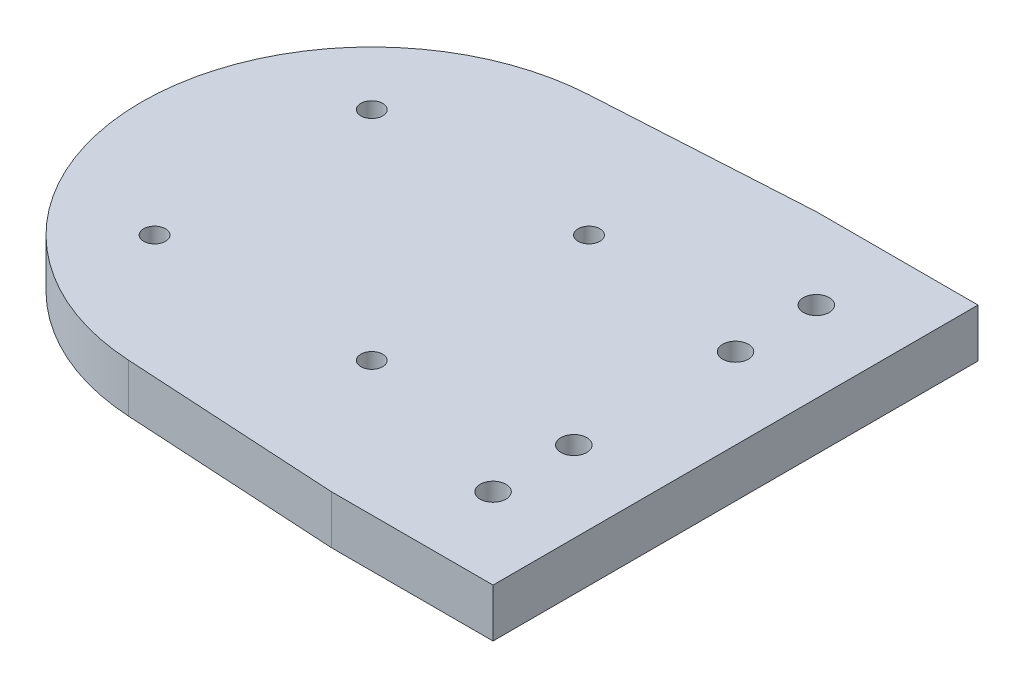
from build123d import *

# Parameters (mm, degrees)
EXTRUDE_1_DEPTH     = 6
SKETCH_2_R          = 1.35
CUT_EXTRUDE_1_DEPTH = 6
SKETCH_4_R          = 1.6
CUT_EXTRUDE_2_DEPTH = 6


with BuildPart() as part:
    # 草图1 → 凸台-拉伸1 (new body)
    with BuildSketch(Plane(origin=(0, 0, 0), x_dir=(1, 0, 0), z_dir=(0, 1, 0))):
        with BuildLine():
            Line((45, -30), (45, 30))
            Line((45, 30), (25, 30))
            Line((25, 30), (-1.65246447, 28.452053725))
            ThreePointArc((-1.65246447, 28.452053725), (-28.5, 0), (-1.65246447, -28.452053725))
            Line((-1.65246447, -28.452053725), (25, -30))
            Line((25, -30), (45, -30))
        make_face()
    extrude(amount=EXTRUDE_1_DEPTH)

    # 草图2 → 切除-拉伸1 (cut)
    with BuildSketch(Plane(origin=(0, 6, 0), x_dir=(1, 0, 0), z_dir=(0, 1, 0))):
        with Locations(Location((-13.435028843, 13.435028843, 0), (0, 0, 270))):
            Circle(SKETCH_2_R)
        with Locations(Location((13.435028843, 13.435028843, 0), (0, 0, 270))):
            Circle(SKETCH_2_R)
        with Locations(Location((13.435028843, -13.435028843, 0), (0, 0, 270))):
            Circle(SKETCH_2_R)
        with Locations(Location((-13.435028843, -13.435028843, 0), (0, 0, 270))):
            Circle(SKETCH_2_R)
    extrude(amount=-CUT_EXTRUDE_1_DEPTH, mode=Mode.SUBTRACT)

    # 草图4 → 切除-拉伸2 (cut)
    with BuildSketch(Plane(origin=(0, 6, 0), x_dir=(1, 0, 0), z_dir=(0, 1, 0))):
        with Locations(Location((35, 20, 0), (0, 0, 270))):
            Circle(SKETCH_4_R)
        with Locations(Location((35, 10, 0), (0, 0, 270))):
            Circle(SKETCH_4_R)
        with Locations(Location((35, -20, 0), (0, 0, 270))):
            Circle(SKETCH_4_R)
        with Locations(Location((35, -10, 0), (0, 0, 270))):
            Circle(SKETCH_4_R)
    extrude(amount=-CUT_EXTRUDE_2_DEPTH, mode=Mode.SUBTRACT)


solid = part.part
